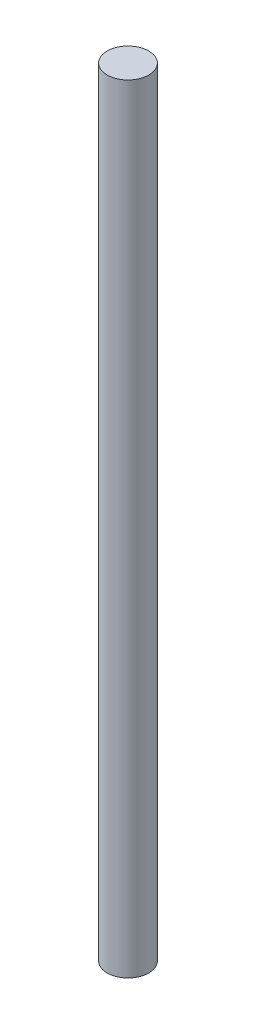
from build123d import *

# Parameters (mm, degrees)
SKETCH1_R           = 4.95
BOSS_EXTRUDE1_DEPTH = 185


with BuildPart() as part:
    # Sketch1 → Boss-Extrude1 (new body)
    with BuildSketch(Plane(origin=(0, 0, 0), x_dir=(1, 0, 0), z_dir=(0, 1, 0))):
        with Locations(Location((0, 0, 0), (0, 0, 270))):
            Circle(SKETCH1_R)
    extrude(amount=BOSS_EXTRUDE1_DEPTH)


solid = part.part
